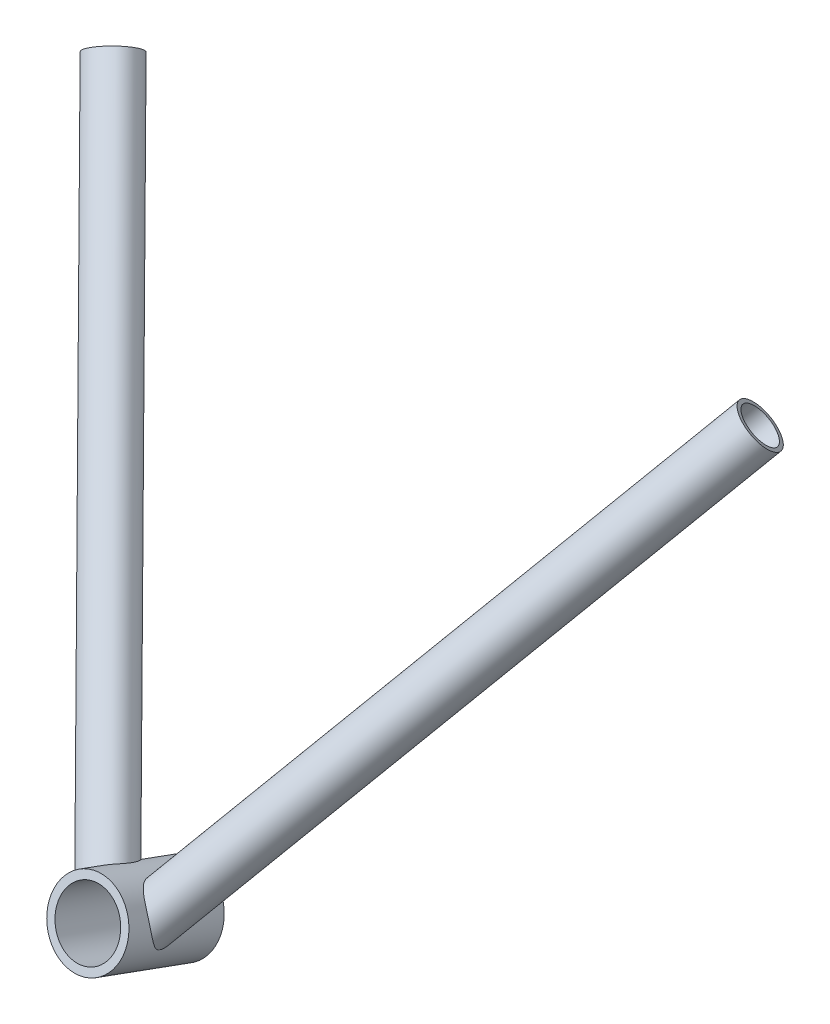
from build123d import *

# Parameters (mm, degrees)
SKETCH1_R               = 15.875
BOSS_EXTRUDE1_DEPTH     = 20.701
SWEEP1_PROFILE_R        = 9.525
SWEEP2_PROFILE_R        = 9.525
CUT_EXTRUDE2_REACH      = 369.057
SKETCH36_R              = 7.9375
CUT_EXTRUDE3_REACH      = 369.057
CUT_EXTRUDE3_END_RADIUS = 15.875
SKETCH37_R              = 7.9375
SKETCH77_R              = 15.875
BOSS_EXTRUDE2_DEPTH     = 41.402
CUT_EXTRUDE1_REACH      = 264.618
SKETCH2_R               = 12.7


with BuildPart() as part:
    # Sketch1 → Boss-Extrude1 (new, symmetric)
    with BuildSketch(Plane(origin=(0, 0, 0), x_dir=(1, 0, 0), z_dir=(0, 0.34202014332566943, 0.9396926207859081))):
        with Locations(Location((0, 0, 0), (0, 0, 270))):
            Circle(SKETCH1_R)
    extrude(amount=BOSS_EXTRUDE1_DEPTH, both=True)

    # Sweep1: sweep along a path in Sketch4
    with BuildLine(Plane(origin=(0, 3.019604439, 4.156128957), x_dir=(1, 0, 0), z_dir=(0, 0.5877852522924744, 0.8090169943749467))) as sweep1_path:
        Line((-5.08, -3.732436352), (-132.08, 216.238016209))
    # Sweep1 profile (on start of the path) → Sweep1 (sweep)
    with BuildSketch(Plane(origin=(-5.08, 0, 6.35), x_dir=(0, 0.5877852522924744, 0.8090169943749466), z_dir=(-0.5000000000000013, 0.7006292692220355, -0.5090369604551278))):
        Circle(SWEEP1_PROFILE_R)
    sweep(path=sweep1_path.line)

    # Sweep2: sweep along a path in Sketch15
    with BuildLine(Plane(origin=(0, 3.019604439, 4.156128957), x_dir=(1, 0, 0), z_dir=(0, 0.5877852522924744, 0.8090169943749467))) as sweep2_path:
        Line((5.08, -3.732436352), (132.08, 216.238016209))
    # Sweep2 profile (on start of the path) → Sweep2 (sweep)
    with BuildSketch(Plane(origin=(5.08, 0, 6.35), x_dir=(0, 0.5877852522924744, 0.8090169943749466), z_dir=(0.500000000000001, 0.7006292692220356, -0.5090369604551279))):
        Circle(SWEEP2_PROFILE_R)
    sweep(path=sweep2_path.line)

    # Sketch36 → Cut-Extrude2 (cut, up to next)
    with BuildSketch(Plane(origin=(-126.653807651, 177.474729397, -128.942938553), x_dir=(0.8655546227004349, 0.3849101606410903, -0.32040499895781577), z_dir=(-0.500000000000001, 0.7006292692220356, -0.5090369604551278)), mode=Mode.PRIVATE) as cut_extrude2_sk1:
        with Locations(Location((-6.431589227, -4.927896453, 0), (0, 0, 268.110697529))):
            Circle(SKETCH36_R)
    cut_extrude2_tool1 = extrude(cut_extrude2_sk1.sketch, amount=-CUT_EXTRUDE2_REACH, mode=Mode.PRIVATE) & part.part
    add(cut_extrude2_tool1.solids().sort_by_distance((-132.08, 177.959834, -122.945388))[0], mode=Mode.SUBTRACT)

    # Cut-Extrude3: up to this cylinder (the profile starts outside it)
    cut_extrude3_end = Plane(origin=(0, -18.696540004, -51.368321484), z_dir=(0, -0.34202014332566943, -0.9396926207859081)) * Cylinder(CUT_EXTRUDE3_END_RADIUS, 770.864, mode=Mode.PRIVATE)
    # Sketch37 → Cut-Extrude3 (cut, up to the surface)
    with BuildSketch(Plane(origin=(126.653807651, 177.474729397, -128.942938553), x_dir=(0.865554622700435, -0.3849101606410899, 0.3204049989578159), z_dir=(0.5000000000000008, 0.7006292692220356, -0.5090369604551279)), mode=Mode.PRIVATE) as cut_extrude3_sk1:
        with Locations(Location((6.431589227, -4.927896453, 0), (0, 0, 271.889302471))):
            Circle(SKETCH37_R)
    cut_extrude3_tool1 = extrude(cut_extrude3_sk1.sketch, amount=-CUT_EXTRUDE3_REACH, mode=Mode.PRIVATE) - cut_extrude3_end
    add(cut_extrude3_tool1.solids().sort_by_distance((132.08, 177.959834, -122.945388))[0], mode=Mode.SUBTRACT)

    # Sketch77 → Boss-Extrude2 (add)
    with BuildSketch(Plane(origin=(0, 7.080158987, 19.452576943), x_dir=(1, 0, 0), z_dir=(0, 0.34202014332566943, 0.9396926207859082))):
        with Locations(Location((0, 0, 0), (0, 0, 270))):
            Circle(SKETCH77_R)
    extrude(amount=-BOSS_EXTRUDE2_DEPTH)

    # Sketch2 → Cut-Extrude1 (cut, up to next)
    with BuildSketch(Plane(origin=(0, -7.080158987, -19.452576943), x_dir=(-1, 0, 0), z_dir=(0, -0.34202014332566943, -0.9396926207859081)), mode=Mode.PRIVATE) as cut_extrude1_sk1:
        with Locations(Location((0, 0, 0), (0, 0, 90))):
            Circle(SKETCH2_R)
    cut_extrude1_tool1 = extrude(cut_extrude1_sk1.sketch, amount=-CUT_EXTRUDE1_REACH, mode=Mode.PRIVATE) & part.part
    add(cut_extrude1_tool1.solids().sort_by_distance((0, -7.080159, -19.452577))[0], mode=Mode.SUBTRACT)


solid = part.part
